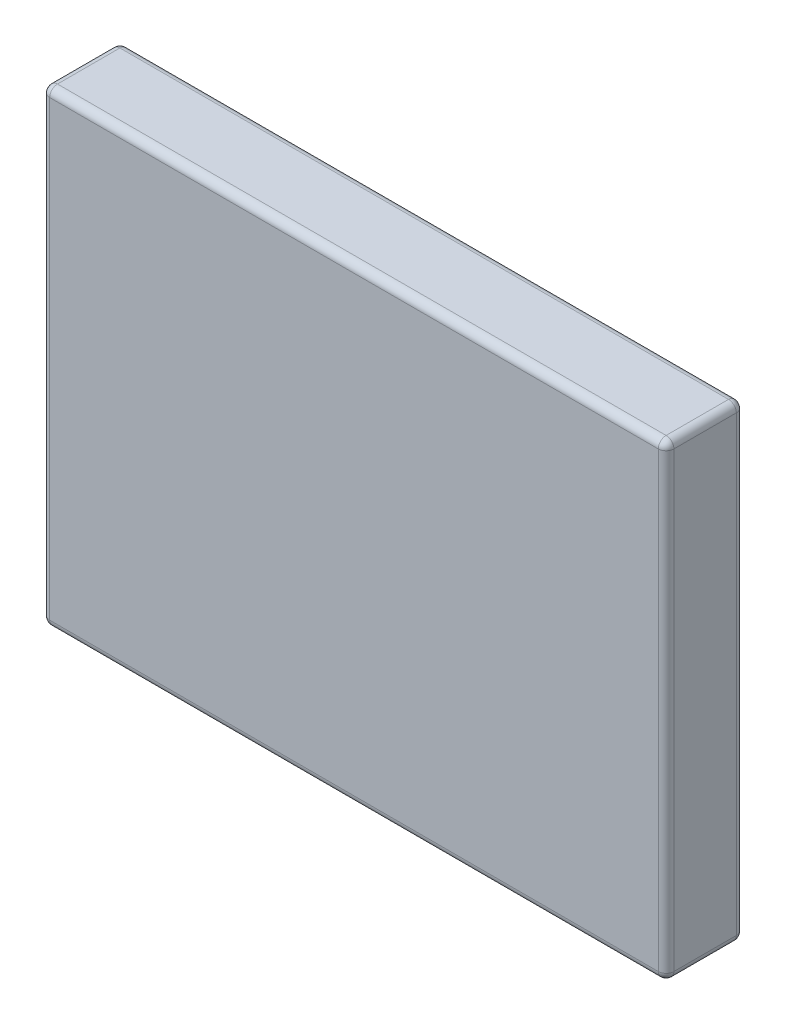
from build123d import *

# Parameters (mm, degrees)
SKETCH1_W           = 101.6
SKETCH1_H           = 76.2
BOSS_EXTRUDE1_DEPTH = 12.7
FILLET2_R           = 1.27


with BuildPart() as part:
    # Sketch1 → Boss-Extrude1 (new body)
    with BuildSketch(Plane.XY):
        with Locations((50.8, 38.1)):
            Rectangle(SKETCH1_W, SKETCH1_H)
    extrude(amount=BOSS_EXTRUDE1_DEPTH)

    # Fillet2
    fillet2_edges = [part.edges().sort_by_distance(p)[0] for p in [
        (101.6, 38.1, 12.7),
        (50.8, 76.2, 12.7),
        (0, 38.1, 12.7),
        (50.8, 76.2, 0),
        (101.6, 38.1, 0),
        (50.8, 0, 0),
        (0, 38.1, 0),
        (0, 76.2, 6.35),
        (101.6, 76.2, 6.35),
        (101.6, 0, 6.35),
        (0, 0, 6.35),
        (50.8, 0, 12.7),
    ]]
    fillet(fillet2_edges, radius=FILLET2_R)


solid = part.part
